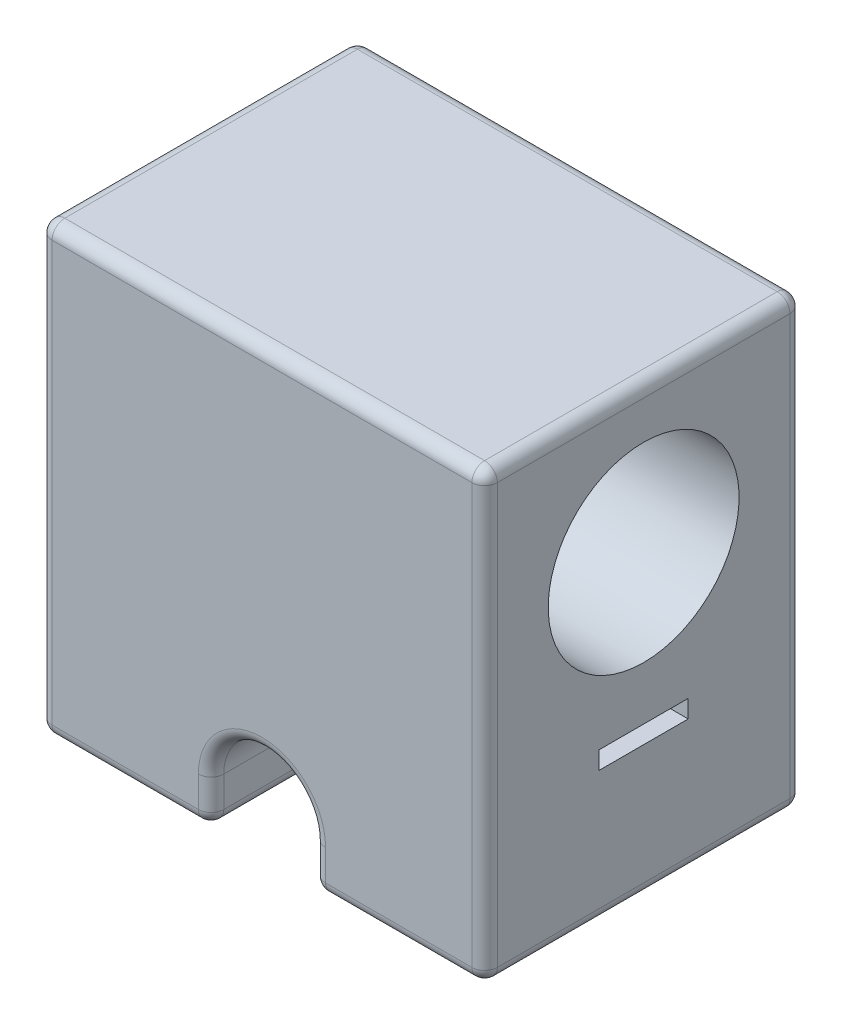
from build123d import *

# Parameters (mm, degrees)
ESTRUSIONE_ESTRUSIONE1_DEPTH = 25
SCHIZZO2_R                   = 7.5
TAGLIO_ESTRUSIONE1_DEPTH     = 47.435439053
SCHIZZO3_W                   = 7
SCHIZZO3_H                   = 1.4
TAGLIO_ESTRUSIONE2_DEPTH     = 47.435439053
RACCORDO2_R                  = 1


with BuildPart() as part:
    # Schizzo1 → Estrusione-Estrusione1 (new body)
    with BuildSketch(Plane.XY):
        with BuildLine():
            Line((-4, -14.085786438), (-4, -16.5))
            ThreePointArc((-4, -16.5), (-4.292893219, -17.207106781), (-5, -17.5))
            Line((-5, -17.5), (-17.5, -17.5))
            Line((-17.5, -17.5), (-17.5, 17.5))
            Line((-17.5, 17.5), (17.5, 17.5))
            Line((17.5, 17.5), (17.5, -17.5))
            Line((17.5, -17.5), (5, -17.5))
            ThreePointArc((5, -17.5), (4.292893219, -17.207106781), (4, -16.5))
            Line((4, -16.5), (4, -14.085786438))
            ThreePointArc((4, -14.085786438), (0, -10.085786438), (-4, -14.085786438))
        make_face()
    extrude(amount=ESTRUSIONE_ESTRUSIONE1_DEPTH)

    # Schizzo2 → Taglio-Estrusione1 (cut, through all)
    with BuildSketch(Plane(origin=(17.5, 0, 0), x_dir=(0, 0, -1), z_dir=(1, 0, 0))):
        with Locations(Location((-12.5, 6, 0), (0, 0, 90))):
            Circle(SCHIZZO2_R)
    extrude(amount=-TAGLIO_ESTRUSIONE1_DEPTH, mode=Mode.SUBTRACT)

    # Schizzo3 → Taglio-Estrusione2 (cut, through all)
    with BuildSketch(Plane(origin=(17.5, 0, 0), x_dir=(0, 0, -1), z_dir=(1, 0, 0))):
        with Locations((-12.5, -6.385786438)):
            Rectangle(SCHIZZO3_W, SCHIZZO3_H)
    extrude(amount=-TAGLIO_ESTRUSIONE2_DEPTH, mode=Mode.SUBTRACT)

    # Raccordo2
    raccordo2_edges = [part.edges().sort_by_distance(p)[0] for p in [
        (-4.292893219, -17.207106781, 25),
        (11.25, -17.5, 0),
        (4.292893219, -17.207106781, 0),
        (4, -15.292893219, 0),
        (0, -10.085786438, 0),
        (-4, -15.292893219, 0),
        (-4.292893219, -17.207106781, 0),
        (-11.25, -17.5, 0),
        (-17.5, 0, 0),
        (-4, -15.292893219, 25),
        (0, -10.085786438, 25),
        (-17.5, 17.5, 12.5),
        (17.5, 17.5, 12.5),
        (17.5, -17.5, 12.5),
        (-17.5, -17.5, 12.5),
        (4, -15.292893219, 25),
        (4.292893219, -17.207106781, 25),
        (11.25, -17.5, 25),
        (17.5, 0, 25),
        (0, 17.5, 25),
        (-17.5, 0, 25),
        (-11.25, -17.5, 25),
        (0, 17.5, 0),
        (17.5, 0, 0),
    ]]
    fillet(raccordo2_edges, radius=RACCORDO2_R)


solid = part.part
